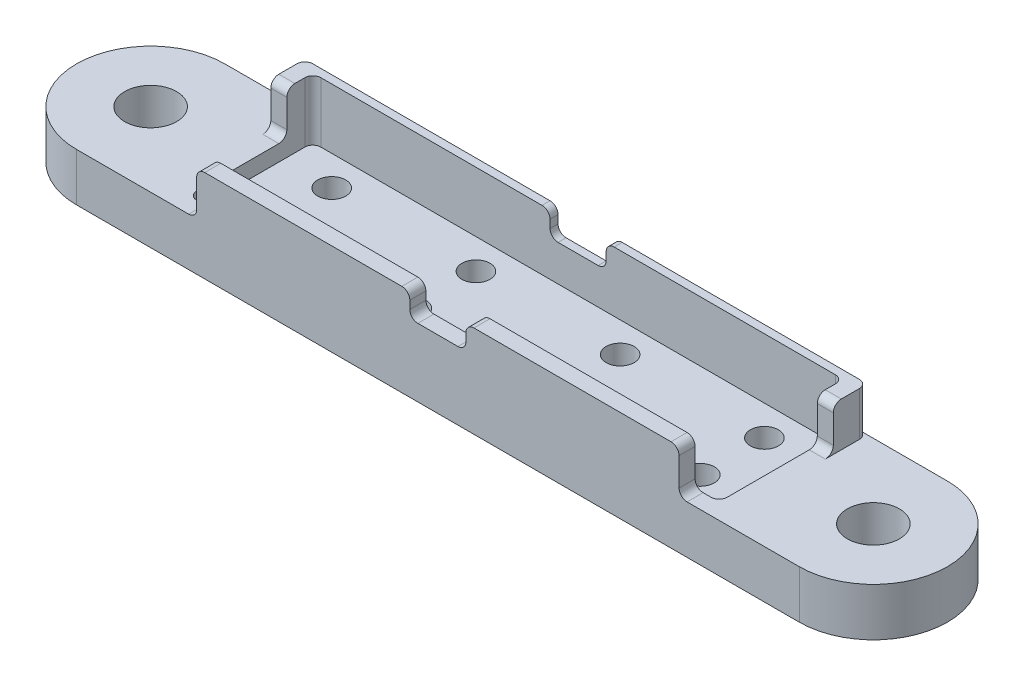
from build123d import *

# Parameters (mm, degrees)
SKETCH1_W           = 35.1
SKETCH1_H           = 18.5
BOSS_EXTRUDE1_DEPTH = 11.5
SKETCH7_W           = 33.1
SKETCH7_H           = 15.5
CUT_EXTRUDE5_DEPTH  = 7.5
SKETCH2_R           = 1.75
CUT_EXTRUDE1_DEPTH  = 39.076534769
SKETCH4_W           = 14.25
SKETCH4_H           = 5.5
CUT_EXTRUDE3_DEPTH  = 5
SKETCH8_R           = 3.25
BOLT_EXTRUDE_DEPTH  = 6
FILLET3_R           = 1
SKETCH9_W           = 7
SKETCH9_H           = 18.5
CUT_EXTRUDE6_DEPTH  = 3
FILLET6_R           = 1


with BuildPart() as part:
    # Sketch1 → Boss-Extrude1 (new body)
    with BuildSketch(Plane(origin=(0, 0, 0), x_dir=(1, 0, 0), z_dir=(0, 1, 0))):
        with Locations((-17.55, 0)):
            Rectangle(SKETCH1_W, SKETCH1_H)
    extrude(amount=BOSS_EXTRUDE1_DEPTH)

    # Sketch7 → Cut-Extrude5 (cut)
    with BuildSketch(Plane(origin=(0, 11.5, 0), x_dir=(1, 0, 0), z_dir=(0, 1, 0))):
        with Locations((-16.55, 0.5)):
            Rectangle(SKETCH7_W, SKETCH7_H)
    extrude(amount=-CUT_EXTRUDE5_DEPTH, mode=Mode.SUBTRACT)

    # Sketch2 → Cut-Extrude1 (cut, through all)
    with BuildSketch(Plane(origin=(0, 0, 0), x_dir=(-1, 0, 0), z_dir=(0, 1, 0))):
        with Locations(Location((27, 3.5, 0), (0, 0, 270))):
            Circle(SKETCH2_R)
        with Locations(Location((9, 3.5, 0), (0, 0, 270))):
            Circle(SKETCH2_R)
        with Locations(Location((27, -4.5, 0), (0, 0, 270))):
            Circle(SKETCH2_R)
        with Locations(Location((9, -4.5, 0), (0, 0, 270))):
            Circle(SKETCH2_R)
    extrude(amount=CUT_EXTRUDE1_DEPTH, mode=Mode.SUBTRACT)

    # Sketch4 → Cut-Extrude3 (cut)
    with BuildSketch(Plane.ZY.offset(35.1)):
        with Locations((2.125, 8.75)):
            Rectangle(SKETCH4_W, SKETCH4_H)
    extrude(amount=-CUT_EXTRUDE3_DEPTH, mode=Mode.SUBTRACT)

    # Sketch8 → bolt extrude (add)
    with BuildSketch(Plane(origin=(0, 0, 0), x_dir=(-1, 0, 0), z_dir=(0, -1, 0))):
        with BuildLine():
            Line((35.1, -9.25), (45.1, -9.25))
            ThreePointArc((45.1, -9.25), (54.35, 0), (45.1, 9.25))
            Line((45.1, 9.25), (35.1, 9.25))
            Line((35.1, 9.25), (35.1, -9.25))
        make_face()
        with Locations(Location((45.1, 0, 0), (0, 0, 90))):
            Circle(SKETCH8_R, mode=Mode.SUBTRACT)
    extrude(amount=-BOLT_EXTRUDE_DEPTH)

    # Mirror1: part across plane


with BuildPart() as part_1:
    add(part.part)
    add(part.part.mirror(Plane(origin=(0, 0, 0), x_dir=(0, 0, 1), z_dir=(1, 0, 0))))

    # Fillet3
    fillet3_edges = [part_1.edges().sort_by_distance(p)[0] for p in [
        (-34.1, 6, -5),
        (-34.1, 11.5, -5),
        (-30.1, 11.5, 8.25),
        (-30.1, 6, 8.25),
        (34.1, 11.5, -5),
        (34.1, 6, -5),
        (30.1, 11.5, 8.25),
        (30.1, 6, 8.25),
    ]]
    fillet(fillet3_edges, radius=FILLET3_R)

    # Sketch9 → Cut-Extrude6 (cut)
    with BuildSketch(Plane(origin=(0, 11.5, 0), x_dir=(1, 0, 0), z_dir=(0, 1, 0))):
        Rectangle(SKETCH9_W, SKETCH9_H)
    extrude(amount=-CUT_EXTRUDE6_DEPTH, mode=Mode.SUBTRACT)

    # Fillet6
    fillet6_edges = [part_1.edges().sort_by_distance(p)[0] for p in [
        (-33.1, 7.75, -8.25),
        (-33.1, 5, 7.25),
        (-3.5, 8.5, -8.75),
        (-3.5, 8.5, 8.25),
        (3.5, 8.5, -8.75),
        (3.5, 8.5, 8.25),
        (-3.5, 11.5, -8.75),
        (3.5, 11.5, -8.75),
        (3.5, 11.5, 8.25),
        (-3.5, 11.5, 8.25),
        (-35.1, 8.75, -9.25),
        (35.1, 8.75, -9.25),
        (33.1, 7.75, -8.25),
        (33.1, 5, 7.25),
    ]]
    fillet(fillet6_edges, radius=FILLET6_R)


solid = part_1.part
